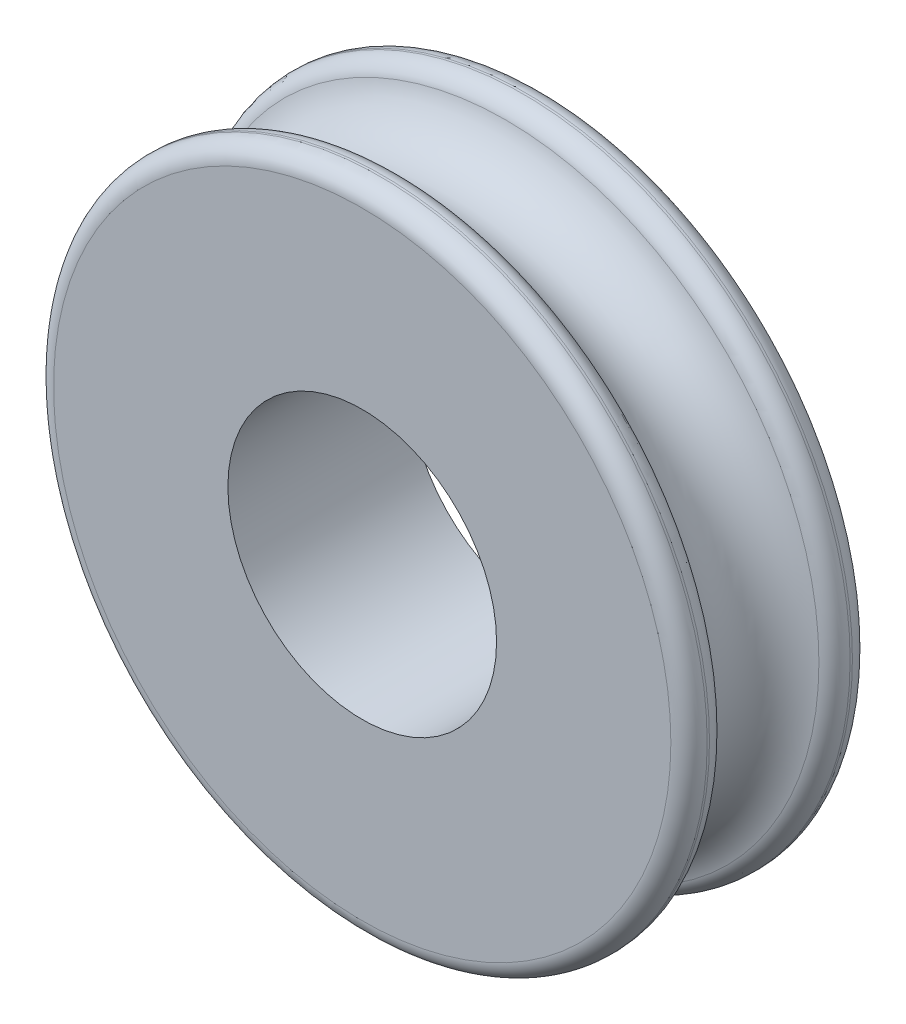
from build123d import *

# Parameters (mm, degrees)
SKETCH_1_R      = 9
SKETCH_1_R_2    = 3.7
EXTRUDE_1_DEPTH = 2.5
SKETCH_3_R      = 1.5
FILLET_1_R      = 0.5
FILLET_2_R      = 0.5


with BuildPart() as part:
    # Эскиз1 → Бобышка-Вытянуть1 (new, symmetric)
    with BuildSketch(Plane.XY):
        Circle(SKETCH_1_R)
        Circle(SKETCH_1_R_2, mode=Mode.SUBTRACT)
    extrude(amount=EXTRUDE_1_DEPTH, both=True)

    # Вырез-По траектории1: sweep along a path in Эскиз4
    with BuildLine(Plane.XY) as sweep_1_path:
        CenterArc((0, 0), 9, 0, 360)
    # Эскиз3 → Вырез-По траектории1 (sweep, cut)
    with BuildSketch(Plane(origin=(0, 0, 0), x_dir=(1, 0, 0), z_dir=(0, 1, 0))):
        with Locations((9, 0)):
            Circle(SKETCH_3_R)
    sweep(path=sweep_1_path.line, mode=Mode.SUBTRACT)

    # Скругление1
    fillet_1_edges = [part.edges().sort_by_distance(p)[0] for p in [
        (-9, 0, -2.5),
        (-9, 0, 2.5),
    ]]
    fillet(fillet_1_edges, radius=FILLET_1_R)

    # Скругление2
    fillet_2_edges = [part.edges().sort_by_distance(p)[0] for p in [
        (-9, 0, 1.5),
        (-9, 0, -1.5),
    ]]
    fillet(fillet_2_edges, radius=FILLET_2_R)


solid = part.part
